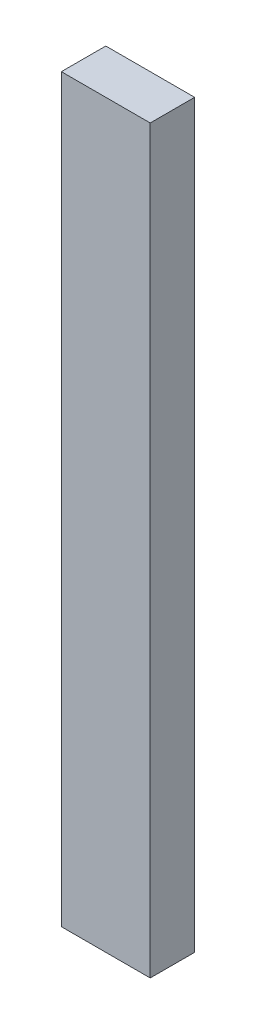
from build123d import *

# Parameters (mm, degrees)
SKETCH1_W           = 12
SKETCH1_H           = 100
BOSS_EXTRUDE1_DEPTH = 6


with BuildPart() as part:
    # Sketch1 → Boss-Extrude1 (new body)
    with BuildSketch(Plane.XY):
        Rectangle(SKETCH1_W, SKETCH1_H)
    extrude(amount=BOSS_EXTRUDE1_DEPTH)


solid = part.part
